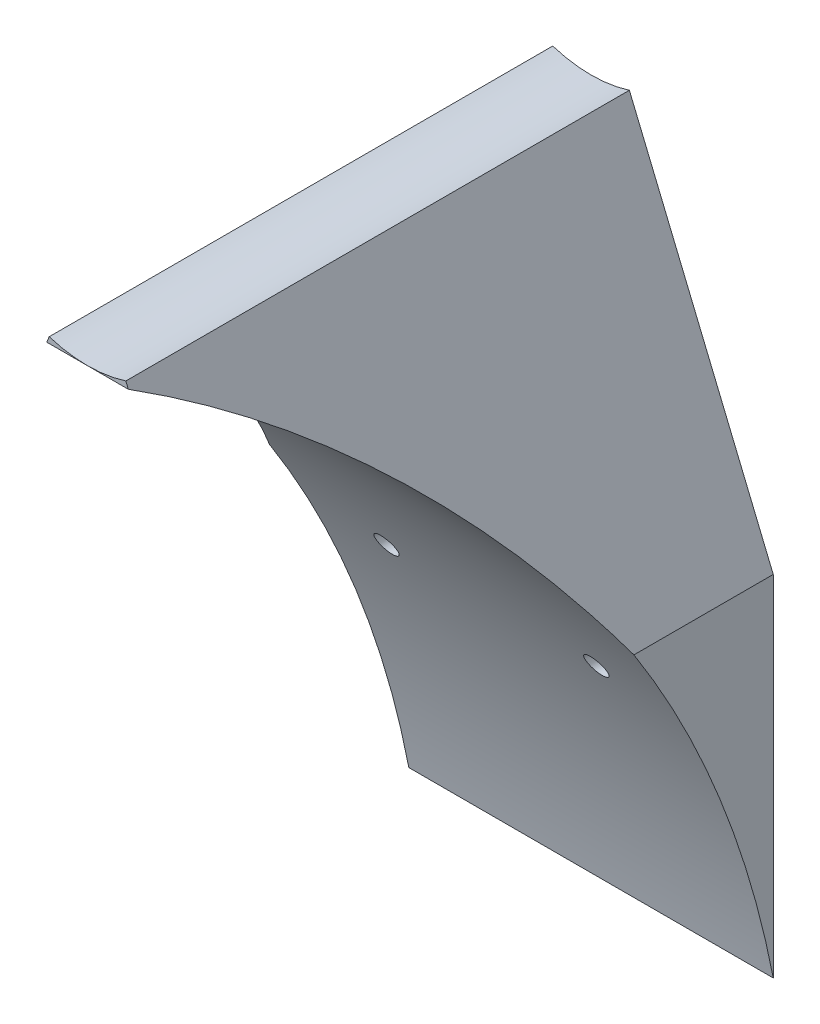
from build123d import *

# Parameters (mm, degrees)
BOSS_EXTRUDE1_DEPTH  = 76.2
CUT_EXTRUDE1_START   = -27.572978
CUT_EXTRUDE1_DEPTH   = 55.145956
M3_CLEARANCE_HOLE1_D = 3.4
CUT_EXTRUDE2_REACH   = 149.802
SKETCH10_R           = 19.05


with BuildPart() as part:
    # Sketch1 → Boss-Extrude1 (new body)
    with BuildSketch(Plane.XY):
        Polygon((27.572977546, -123.606903324), (27.572977546, -70.715393761), (0, -4.148337413), (-27.572977546, -70.715393761), (-27.572977546, -123.606903324), align=None)
    extrude(amount=BOSS_EXTRUDE1_DEPTH)

    # Sketch2 → Cut-Extrude1 (cut)
    with BuildSketch(Plane(origin=(0, 0, 0), x_dir=(0, 0, -1), z_dir=(1, 0, 0)).offset(CUT_EXTRUDE1_START)):
        with BuildLine():
            Line((-76.2, -123.606903324), (0, -123.606903324))
            ThreePointArc((0, -123.606903324), (-26.454151539, -62.84107661), (-76.2, -19.05))
            Line((-76.2, -19.05), (-76.2, -70.715393761))
            Line((-76.2, -70.715393761), (-76.2, -123.606903324))
        make_face()
    extrude(amount=CUT_EXTRUDE1_DEPTH, mode=Mode.SUBTRACT)

    # M3 Clearance Hole1 (through all)
    with Locations(Plane(origin=(0, 0, 0), x_dir=(-1, 0, 0), z_dir=(0, 0, -1))):
        with Locations((-15.875, -81.009177721), (15.875, -81.009177721), (0, -38.1)):
            Hole(M3_CLEARANCE_HOLE1_D / 2)

    # Sketch10 → Cut-Extrude2 (cut, up to next)
    with BuildSketch(Plane(origin=(0, 0, 0), x_dir=(-1, 0, 0), z_dir=(0, 0, -1)), mode=Mode.PRIVATE) as cut_extrude2_sk1:
        Circle(SKETCH10_R)
    cut_extrude2_tool1 = extrude(cut_extrude2_sk1.sketch, amount=-CUT_EXTRUDE2_REACH, mode=Mode.PRIVATE) & part.part
    add(cut_extrude2_tool1.solids().sort_by_distance((0, 0, 0))[0], mode=Mode.SUBTRACT)


solid = part.part
